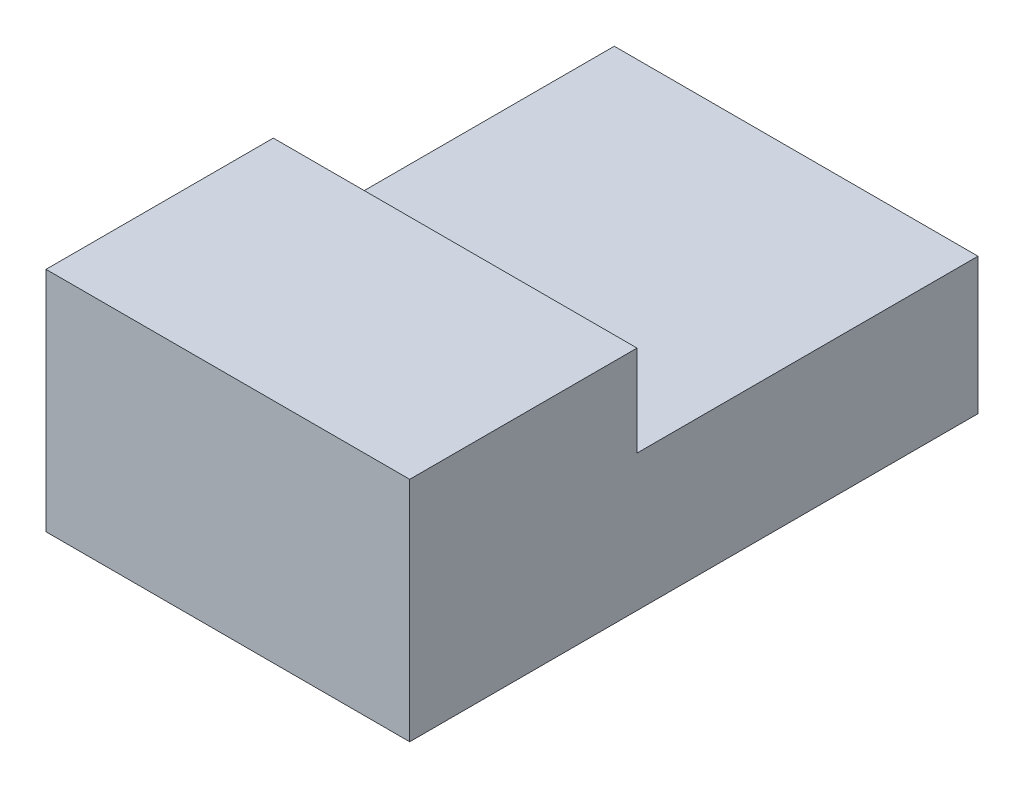
from build123d import *

# Parameters (mm, degrees)
Y_KSEKLIK_EKSTR_ZYON5_DEPTH = 160
IZIM8_W                     = 154.6
IZIM8_H                     = 37.3
KES_EKSTR_ZYON4_DEPTH       = 97.3


with BuildPart() as part:
    # Çizim7 → Yükseklik-Ekstrüzyon5 (new body)
    with BuildSketch(Plane(origin=(0, 0, 0), x_dir=(0, 0, -1), z_dir=(1, 0, 0))):
        Polygon((0, 0), (0, 100), (100, 100), (100, 60), (250, 60), (250, 0), align=None)
    extrude(amount=Y_KSEKLIK_EKSTR_ZYON5_DEPTH)

    # Çizim8 → Kes-Ekstrüzyon4 (cut)
    with BuildSketch(Plane(origin=(0, 0, -100), x_dir=(-1, 0, 0), z_dir=(0, 0, -1))):
        with Locations((-80, 78.65)):
            Rectangle(IZIM8_W, IZIM8_H)
    extrude(amount=-KES_EKSTR_ZYON4_DEPTH, mode=Mode.SUBTRACT)


solid = part.part
